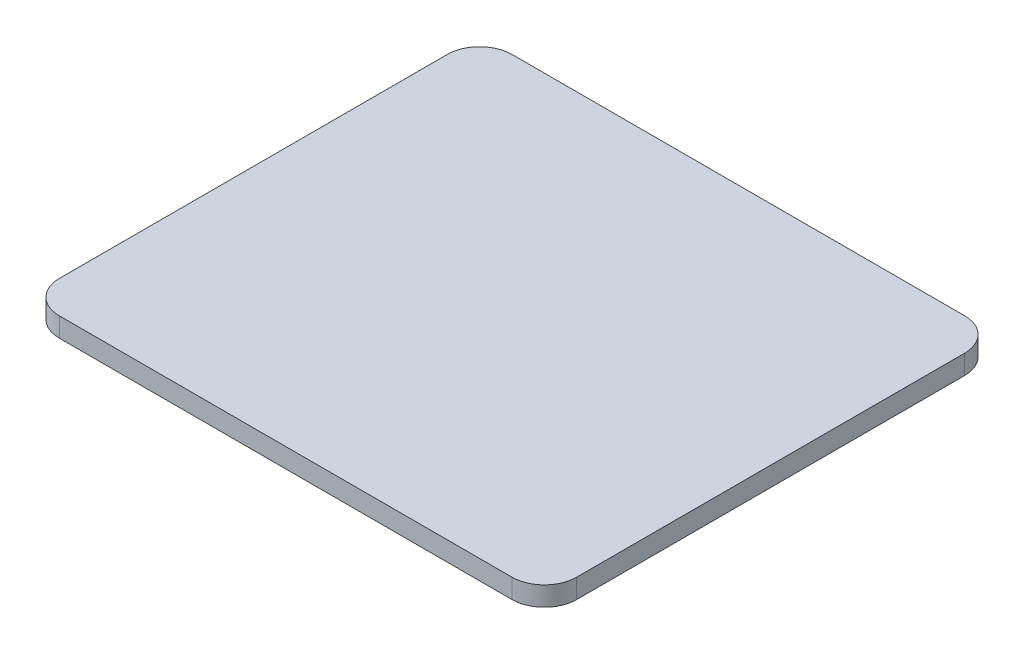
from build123d import *

# Parameters (mm, degrees)
CROQUIS2_R              = 1
SALIENTE_EXTRUIR1_DEPTH = 7
SALIENTE_EXTRUIR2_DEPTH = 3
CROQUIS4_R              = 2.5
CORTAR_EXTRUIR1_DEPTH   = 2.6
CROQUIS5_R              = 2.6
CORTAR_EXTRUIR3_DEPTH   = 2.2


with BuildPart() as part:
    # Croquis2 → Saliente-Extruir1 (new body)
    with BuildSketch(Plane(origin=(0, 0, 0), x_dir=(0, 0, -1), z_dir=(1, 0, 0))):
        with BuildLine():
            Line((-5, 0), (-5, 20))
            Line((-5, 20), (5, 20))
            Line((5, 20), (5, 0))
            ThreePointArc((5, 0), (0, -5), (-5, 0))
        make_face()
        Circle(CROQUIS2_R, mode=Mode.SUBTRACT)
    extrude(amount=SALIENTE_EXTRUIR1_DEPTH)

    # Croquis3 → Saliente-Extruir2 (add)
    with BuildSketch(Plane(origin=(0, 20, 0), x_dir=(1, 0, 0), z_dir=(0, 1, 0))):
        with BuildLine():
            Line((-27.897521221, -35), (42.102478779, -35))
            ThreePointArc((42.102478779, -35), (45.638012685, -33.535533906), (47.102478779, -30))
            Line((47.102478779, -30), (47.102478779, 30))
            ThreePointArc((47.102478779, 30), (45.638012685, 33.535533906), (42.102478779, 35))
            Line((42.102478779, 35), (-27.897521221, 35))
            ThreePointArc((-27.897521221, 35), (-31.433055127, 33.535533906), (-32.897521221, 30))
            Line((-32.897521221, 30), (-32.897521221, -30))
            ThreePointArc((-32.897521221, -30), (-31.433055127, -33.535533906), (-27.897521221, -35))
        make_face()
    extrude(amount=SALIENTE_EXTRUIR2_DEPTH)

    # Croquis4 → Cortar-Extruir1 (cut)
    with BuildSketch(Plane(origin=(7, 0, 0), x_dir=(0, 0, -1), z_dir=(1, 0, 0))):
        Circle(CROQUIS4_R)
    extrude(amount=-CORTAR_EXTRUIR1_DEPTH, mode=Mode.SUBTRACT)

    # Croquis5 → Cortar-Extruir3 (cut)
    with BuildSketch(Plane.ZY):
        Circle(CROQUIS5_R)
    extrude(amount=-CORTAR_EXTRUIR3_DEPTH, mode=Mode.SUBTRACT)


solid = part.part
